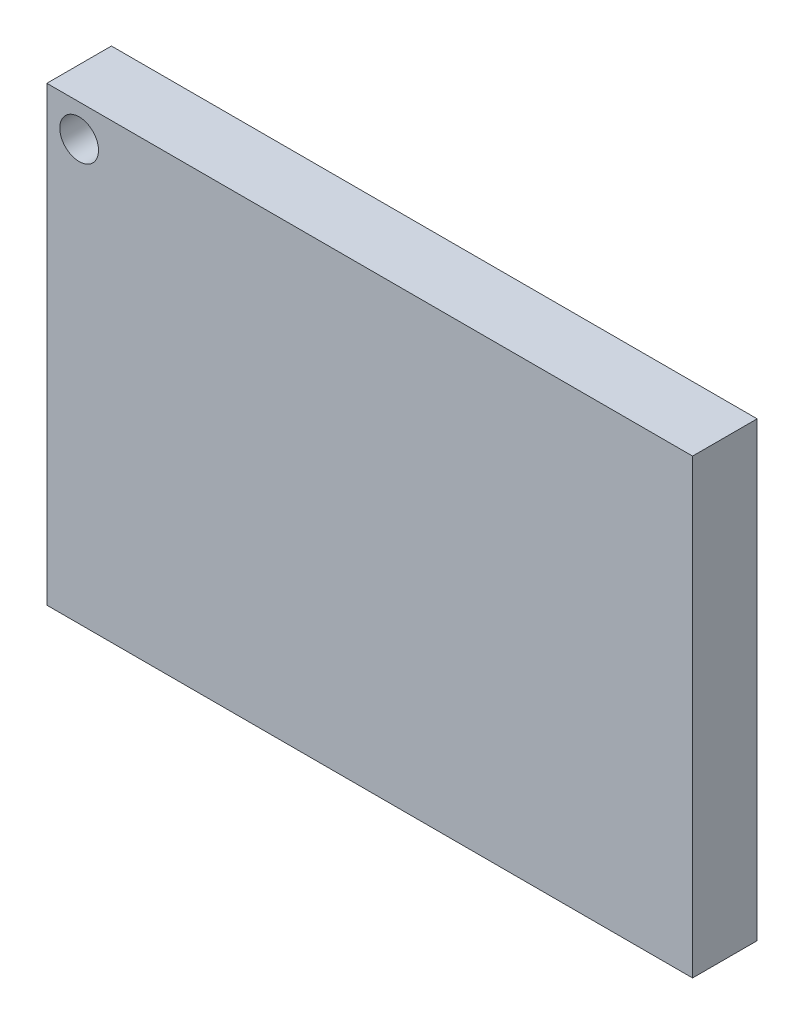
from build123d import *

# Parameters (mm, degrees)
SKETCH_1_W          = 100
SKETCH_1_H          = 70
EXTRUDE_1_DEPTH     = 5
SKETCH_2_R          = 3
CUT_EXTRUDE_1_DEPTH = 10


with BuildPart() as part:
    # 草图1 → 凸台-拉伸1 (new, symmetric)
    with BuildSketch(Plane.XY):
        Rectangle(SKETCH_1_W, SKETCH_1_H)
    extrude(amount=EXTRUDE_1_DEPTH, both=True)

    # 草图2 → 切除-拉伸1 (cut)
    with BuildSketch(Plane.XY.offset(5)):
        with Locations((-45, 30)):
            Circle(SKETCH_2_R)
    extrude(amount=-CUT_EXTRUDE_1_DEPTH, mode=Mode.SUBTRACT)


solid = part.part
